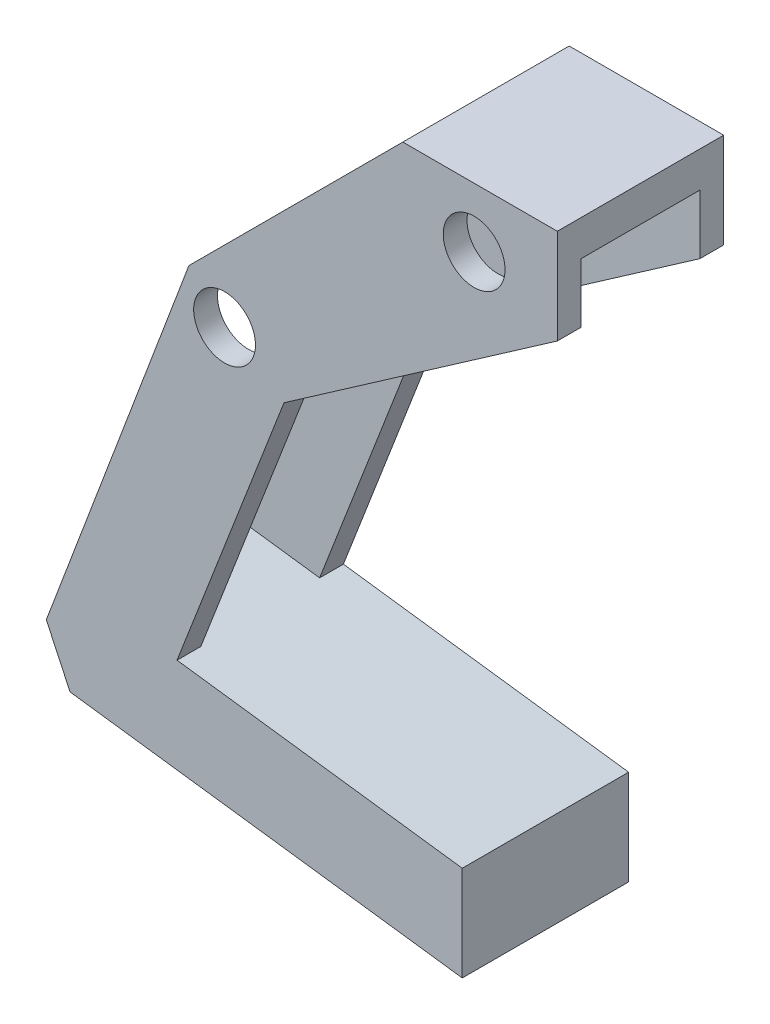
from build123d import *

# Parameters (mm, degrees)
EXTRUDE_2_DEPTH                = 14
FORK_ABOVE_MOUNTING_FOOT_DEPTH = 5
SKETCH_4_R                     = 2.6
OUTER_PIVOT_BORE_DEPTH         = 83.58934556
SKETCH_5_R                     = 2.6
UPPER_HINGE_BORE_DEPTH         = 83.58934556


with BuildPart() as part:
    # 草图1 → Extrude 2 (new body)
    with BuildSketch(Plane.XY):
        Polygon((-12, 60), (-25, 60), (-43, 42), (-55, 10.187667387), (-53, 5.924362391), (-20, 1.579829971), (-20, 9.579829971), (-44, 12.739489913), (-35, 36), (-12, 52), align=None)
    extrude(amount=EXTRUDE_2_DEPTH)

    # 草图3 → Fork_above_mounting_foot (cut, symmetric)
    with BuildSketch(Plane.XY.offset(7)):
        Polygon((5, 6.288517531), (-65, 15.504192362), (-65, 57), (5, 57), align=None)
    extrude(amount=FORK_ABOVE_MOUNTING_FOOT_DEPTH, both=True, mode=Mode.SUBTRACT)

    # 草图4 → Outer_pivot_bore (cut, through all)
    with BuildSketch(Plane.XY.offset(14)):
        with Locations((-40, 39)):
            Circle(SKETCH_4_R)
    extrude(amount=-OUTER_PIVOT_BORE_DEPTH, mode=Mode.SUBTRACT)

    # 草图5 → Upper_hinge_bore (cut, through all)
    with BuildSketch(Plane.XY.offset(14)):
        with Locations((-19, 55)):
            Circle(SKETCH_5_R)
    extrude(amount=-UPPER_HINGE_BORE_DEPTH, mode=Mode.SUBTRACT)


solid = part.part
